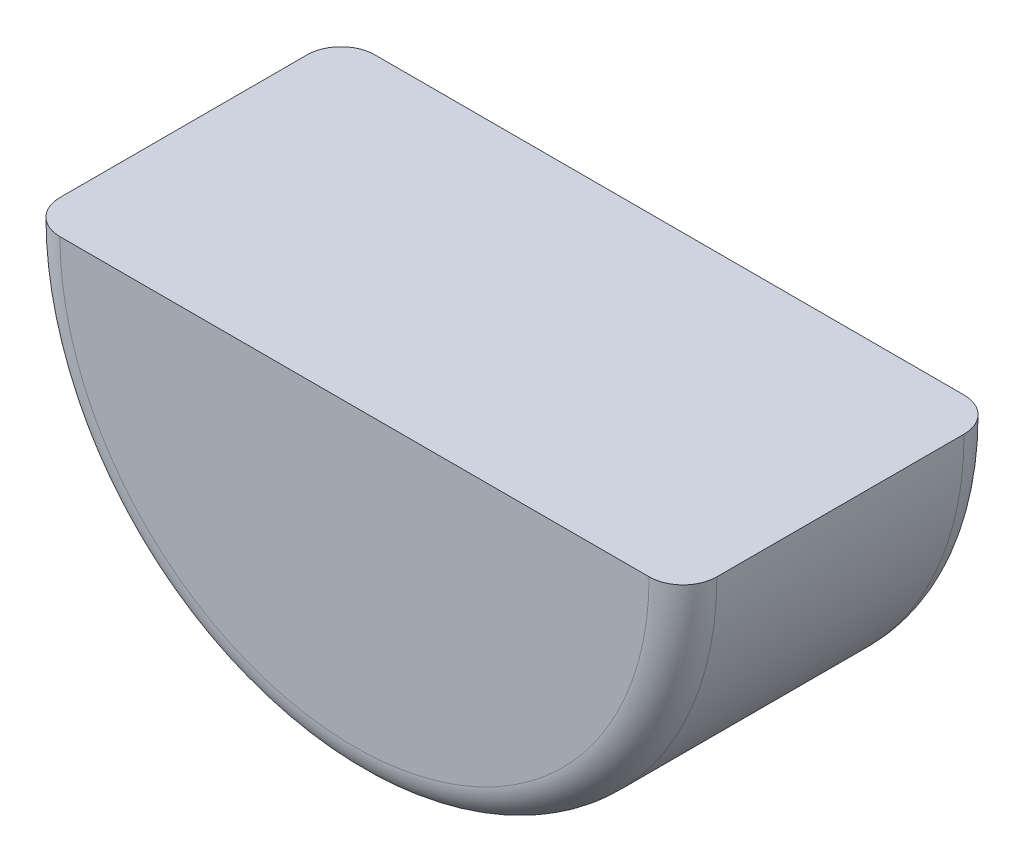
from build123d import *

# Parameters (mm, degrees)
R_VOLUTION1_ANGLE = 180


with BuildPart() as part:
    # Esquisse1 → Révolution1 (revolve)
    with BuildSketch(Plane(origin=(0, 0, 0), x_dir=(1, 0, 0), z_dir=(0, 1, 0))):
        with BuildLine():
            Line((0, -46.5), (0, 46.5))
            Line((0, 46.5), (87, 46.5))
            ThreePointArc((87, 46.5), (94.071067812, 43.571067812), (97, 36.5))
            Line((97, 36.5), (97, -36.5))
            ThreePointArc((97, -36.5), (94.071067812, -43.571067812), (87, -46.5))
            Line((87, -46.5), (0, -46.5))
        make_face()
    revolve(axis=Axis((0, 0, 46.5), (0, 0, -1)), revolution_arc=R_VOLUTION1_ANGLE)


solid = part.part
